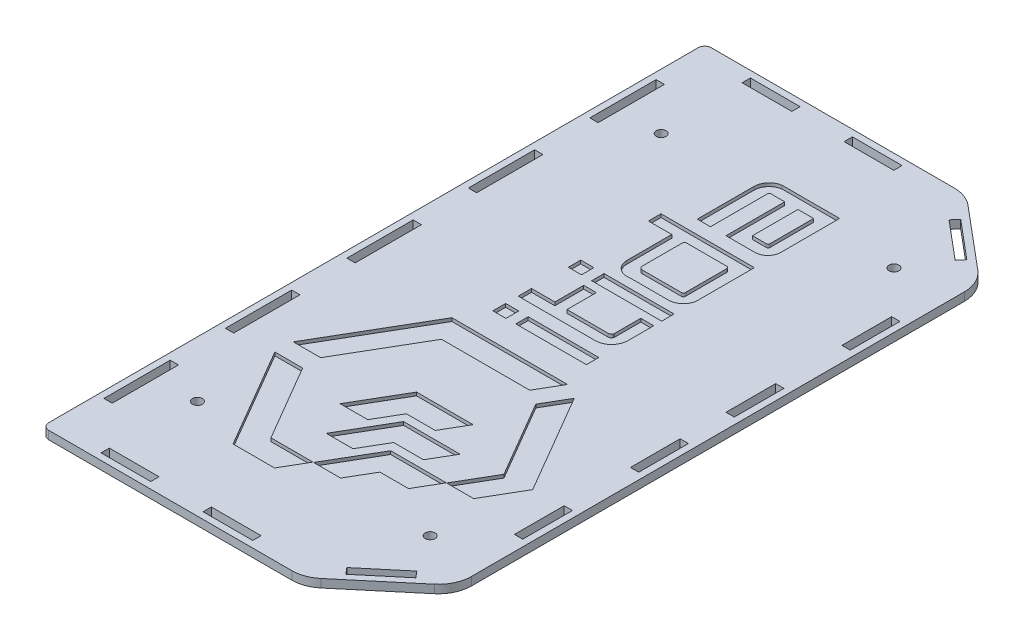
from build123d import *

# Parameters (mm, degrees)
SKETCH1_R           = 1.5
SKETCH1_W           = 15
SKETCH1_H           = 2.5
SKETCH1_W_2         = 2.5
SKETCH1_H_2         = 15
SKETCH1_H_3         = 20
BOSS_EXTRUDE1_DEPTH = 1.25
FILLET1_R           = 10
FILLET2_R           = 2
SKETCH2_W           = 21.143605029
SKETCH2_H           = 3.744659356
SKETCH2_W_2         = 3.954296461
SKETCH2_H_2         = 3.857953454
SKETCH2_W_3         = 21.298249183
SKETCH2_H_3         = 3.744659357
CUT_EXTRUDE2_DEPTH  = 1


with BuildPart() as part:
    # Sketch1 → Boss-Extrude1 (new, symmetric)
    with BuildSketch(Plane(origin=(0, 0, 0), x_dir=(1, 0, 0), z_dir=(0, 1, 0))):
        Polygon((-52, -100), (27, -100), (52, -79.022509221), (52, 79.022509221), (27, 100), (-52, 100), align=None)
        with Locations(Location((35.127158073, -70, 0), (0, 0, 270))):
            Circle(SKETCH1_R, mode=Mode.SUBTRACT)
        with Locations(Location((35.127158073, 70, 0), (0, 0, 270))):
            Circle(SKETCH1_R, mode=Mode.SUBTRACT)
        with Locations(Location((-35.127158073, 70, 0), (0, 0, 270))):
            Circle(SKETCH1_R, mode=Mode.SUBTRACT)
        with Locations(Location((-35.127158073, -70, 0), (0, 0, 270))):
            Circle(SKETCH1_R, mode=Mode.SUBTRACT)
        with Locations((-28.71, -96.75)):
            Rectangle(SKETCH1_W, SKETCH1_H, mode=Mode.SUBTRACT)
        with Locations((2.08, -96.75)):
            Rectangle(SKETCH1_W, SKETCH1_H, mode=Mode.SUBTRACT)
        with Locations((-28.71, 96.75)):
            Rectangle(SKETCH1_W, SKETCH1_H, mode=Mode.SUBTRACT)
        with Locations((2.08, 96.75)):
            Rectangle(SKETCH1_W, SKETCH1_H, mode=Mode.SUBTRACT)
        Polygon((30.862122433, -90.884961689), (32.469091457, -92.800072797), (43.959758104, -83.158258651), (42.35278908, -81.243147544), align=None, mode=Mode.SUBTRACT)
        with Locations((48.75, 14.424124759)):
            Rectangle(SKETCH1_W_2, SKETCH1_H_2, mode=Mode.SUBTRACT)
        with Locations((48.75, -49.424124759)):
            Rectangle(SKETCH1_W_2, SKETCH1_H_2, mode=Mode.SUBTRACT)
        with Locations((48.75, -14.424124759)):
            Rectangle(SKETCH1_W_2, SKETCH1_H_2, mode=Mode.SUBTRACT)
        with Locations((48.75, 49.424124759)):
            Rectangle(SKETCH1_W_2, SKETCH1_H_2, mode=Mode.SUBTRACT)
        Polygon((42.35278908, 81.243147544), (30.862122433, 90.884961689), (32.469091457, 92.800072797), (43.959758104, 83.158258651), align=None, mode=Mode.SUBTRACT)
        with Locations((-48.75, -36.666666667)):
            Rectangle(SKETCH1_W_2, SKETCH1_H_3, mode=Mode.SUBTRACT)
        with Locations((-48.75, -73.333333333)):
            Rectangle(SKETCH1_W_2, SKETCH1_H_3, mode=Mode.SUBTRACT)
        with Locations((-48.75, 0)):
            Rectangle(SKETCH1_W_2, SKETCH1_H_3, mode=Mode.SUBTRACT)
        with Locations((-48.75, 36.666666667)):
            Rectangle(SKETCH1_W_2, SKETCH1_H_3, mode=Mode.SUBTRACT)
        with Locations((-48.75, 73.333333333)):
            Rectangle(SKETCH1_W_2, SKETCH1_H_3, mode=Mode.SUBTRACT)
    extrude(amount=BOSS_EXTRUDE1_DEPTH, both=True)

    # Fillet1
    fillet1_edges = [part.edges().sort_by_distance(p)[0] for p in [
        (27, 0, -100),
        (52, 0, -79.022509221),
        (52, 0, 79.022509221),
        (27, 0, 100),
    ]]
    fillet(fillet1_edges, radius=FILLET1_R)

    # Fillet2
    fillet2_edges = [part.edges().sort_by_distance(p)[0] for p in [
        (-52, 0, 100),
        (-52, 0, -100),
    ]]
    fillet(fillet2_edges, radius=FILLET2_R)

    # Sketch2 → Cut-Extrude2 (cut)
    # profile 1 of 13: a face of its own
    with BuildSketch(Plane(origin=(0, 1.25, 0), x_dir=(1, 0, 0), z_dir=(0, 1, 0))):
        with BuildLine():
            Line((-2.152622234, 27.563952588), (9.501897202, 27.563952588))
            ThreePointArc((9.501897202, 27.563952588), (12.480302582, 28.685188985), (13.979900977, 31.492193496))
            Line((13.979900977, 31.492193496), (13.979900977, 49.010457465))
            Line((13.979900977, 49.010457465), (-14.200979289, 49.010457465))
            Line((-14.200979289, 49.010457465), (-14.200979289, 45.21713259))
            Line((-14.200979289, 45.21713259), (-7.163704052, 45.21713259))
            Line((-7.163704052, 45.21713259), (-7.163704052, 31.702125179))
            ThreePointArc((-7.163704052, 31.702125179), (-5.632903346, 28.452686251), (-2.152622234, 27.563952588))
        make_face()
        with BuildLine():
            Line((-2.307266388, 45.21713259), (9.479298356, 45.21713259))
            ThreePointArc((9.479298356, 45.21713259), (9.959888987, 44.982106496), (10.069465175, 44.458467615))
            Line((10.069465175, 44.458467615), (10.069465175, 32.250858471))
            ThreePointArc((10.069465175, 32.250858471), (9.959888987, 31.72721959), (9.479298356, 31.492193496))
            Line((9.479298356, 31.492193496), (-2.307266388, 31.492193496))
            ThreePointArc((-2.307266388, 31.492193496), (-2.949502916, 31.702125179), (-3.343750101, 32.250858471))
            Line((-3.343750101, 32.250858471), (-3.343750101, 44.458467615))
            ThreePointArc((-3.343750101, 44.458467615), (-3.017943576, 45.100704143), (-2.307266388, 45.21713259))
        make_face(mode=Mode.SUBTRACT)
    # profile 2 of 13: a face of its own
    with BuildSketch(Plane(origin=(0, 1.25, 0), x_dir=(1, 0, 0), z_dir=(0, 1, 0))):
        with BuildLine():
            ThreePointArc((-7.318348206, 70.184107222), (-6.184863233, 73.205615194), (-3.343750101, 74.736097072))
            Line((-3.343750101, 74.736097072), (13.979900977, 74.736097072))
            Line((13.979900977, 74.736097072), (13.979900977, 57.079894017))
            ThreePointArc((13.979900977, 57.079894017), (12.866489319, 54.256867985), (10.069465175, 53.079660513))
            Line((10.069465175, 53.079660513), (1.34089226, 53.079660513))
            Line((1.34089226, 53.079660513), (1.34089226, 70.804833111))
            Line((1.34089226, 70.804833111), (-2.307266388, 70.804833111))
            ThreePointArc((-2.307266388, 70.804833111), (-3.001402151, 70.788176572), (-3.343750101, 70.184107222))
            Line((-3.343750101, 70.184107222), (-3.343750101, 53.079660513))
            Line((-3.343750101, 53.079660513), (-7.318348206, 53.079660513))
            Line((-7.318348206, 53.079660513), (-7.318348206, 70.184107222))
        make_face()
        with BuildLine():
            ThreePointArc((9.479298356, 57.079894017), (9.933164158, 57.288872921), (10.069465175, 57.769589449))
            Line((10.069465175, 57.769589449), (10.069465175, 70.804833111))
            Line((10.069465175, 70.804833111), (5.341125765, 70.804833111))
            Line((5.341125765, 70.804833111), (5.341125765, 57.079894017))
            Line((5.341125765, 57.079894017), (9.479298356, 57.079894017))
        make_face(mode=Mode.SUBTRACT)
    # profile 3 of 13: a face of its own
    with BuildSketch(Plane(origin=(0, 1.25, 0), x_dir=(1, 0, 0), z_dir=(0, 1, 0))):
        with Locations((3.408098463, 22.913740882)):
            Rectangle(SKETCH2_W, SKETCH2_H)
    # profile 4 of 13: a face of its own
    with BuildSketch(Plane(origin=(0, 1.25, 0), x_dir=(1, 0, 0), z_dir=(0, 1, 0))):
        with Locations((-12.223831059, 22.913740882)):
            Rectangle(SKETCH2_W_2, SKETCH2_H)
    # profile 5 of 13: a face of its own
    with BuildSketch(Plane(origin=(0, 1.25, 0), x_dir=(1, 0, 0), z_dir=(0, 1, 0))):
        with BuildLine():
            Line((-14.200979289, 5.922499), (9.015959154, 5.922499))
            ThreePointArc((9.015959154, 5.922499), (12.479684368, 7.329983053), (13.979900977, 10.754563881))
            Line((13.979900977, 10.754563881), (13.979900977, 18.633433136))
            Line((13.979900977, 18.633433136), (10.069465175, 18.633433136))
            Line((10.069465175, 18.633433136), (10.069465175, 10.544325397))
            ThreePointArc((10.069465175, 10.544325397), (9.663559377, 9.998629883), (9.015959154, 9.790887105))
            Line((9.015959154, 9.790887105), (-3.343750101, 9.790887105))
            Line((-3.343750101, 9.790887105), (-3.343750101, 18.633433136))
            Line((-3.343750101, 18.633433136), (-7.163704052, 18.633433136))
            Line((-7.163704052, 18.633433136), (-7.163704052, 9.931514205))
            Line((-7.163704052, 9.931514205), (-14.200979289, 9.931514205))
            Line((-14.200979289, 9.931514205), (-14.200979289, 5.922499))
        make_face()
    # profile 6 of 13: a face of its own
    with BuildSketch(Plane(origin=(0, 1.25, 0), x_dir=(1, 0, 0), z_dir=(0, 1, 0))):
        with Locations((-12.223831059, 0.186222933)):
            Rectangle(SKETCH2_W_2, SKETCH2_H_2)
    # profile 7 of 13: a face of its own
    with BuildSketch(Plane(origin=(0, 1.25, 0), x_dir=(1, 0, 0), z_dir=(0, 1, 0))):
        with Locations((3.330776386, 0.181781217)):
            Rectangle(SKETCH2_W_3, SKETCH2_H_3)
    # profile 8 of 13: a face of its own
    with BuildSketch(Plane(origin=(0, 1.25, 0), x_dir=(1, 0, 0), z_dir=(0, 1, 0))):
        Polygon((-18.583565292, -9.721303383), (-36.215372386, -39.976136134), (-27.951509672, -39.976136134), (-14.518079066, -16.925396405), (12.114183586, -16.925396405), (16.312560073, -9.721303383), align=None)
    # profile 9 of 13: a face of its own
    with BuildSketch(Plane(origin=(0, 1.25, 0), x_dir=(1, 0, 0), z_dir=(0, 1, 0))):
        Polygon((-4.486010915, -34.490088331), (-12.987099053, -49.077305537), (-4.639287252, -49.077305537), (-0.336878782, -41.694701588), (8.373294525, -41.694701588), (12.571974194, -34.490088331), align=None)
    # profile 10 of 13: a face of its own
    with BuildSketch(Plane(origin=(0, 1.25, 0), x_dir=(1, 0, 0), z_dir=(0, 1, 0))):
        Polygon((0.724462335, -58.900529035), (-7.318348206, -58.900529035), (1.270297131, -44.163070371), (18.324092355, -44.163070371), (14.258708095, -51.1389589), (5.247723412, -51.1389589), align=None)
    # profile 11 of 13: a face of its own
    with BuildSketch(Plane(origin=(0, 1.25, 0), x_dir=(1, 0, 0), z_dir=(0, 1, 0))):
        Polygon((23.736499876, -53.728647081), (19.540059539, -60.936273615), (10.911968776, -60.936273615), (6.55073382, -68.426944342), (-1.617926582, -68.426944342), (6.939748712, -53.728647081), align=None)
    # profile 12 of 13: a face of its own
    with BuildSketch(Plane(origin=(0, 1.25, 0), x_dir=(1, 0, 0), z_dir=(0, 1, 0))):
        Polygon((23.820625219, -53.728647081), (30.187544422, -42.793098833), (16.676462266, -19.652571384), (20.946374968, -12.318751859), (38.547172239, -42.46376376), (31.988506839, -53.728647081), align=None)
    # profile 13 of 13: a face of its own
    with BuildSketch(Plane(origin=(0, 1.25, 0), x_dir=(1, 0, 0), z_dir=(0, 1, 0))):
        Polygon((-6.07550213, -75.76445103), (-1.803442681, -68.426944342), (-14.509086737, -68.426944342), (-27.951509672, -45.404010033), (-36.33800622, -45.404010033), (-18.611426155, -75.76445103), align=None)
    extrude(amount=-CUT_EXTRUDE2_DEPTH, mode=Mode.SUBTRACT)


solid = part.part
